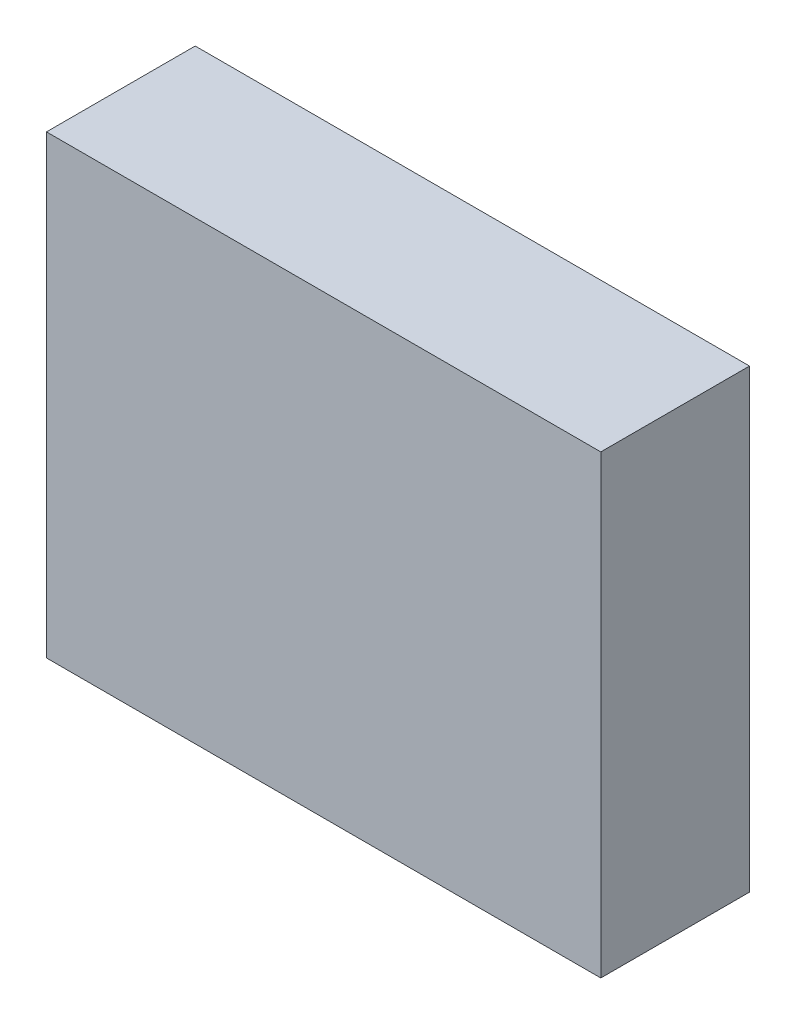
from build123d import *

# Parameters (mm, degrees)
SKETCH1_W               = 3.727
SKETCH1_H               = 3.0635
COMPONENT_OUTLINE_DEPTH = 1


with BuildPart() as part:
    # Sketch1 → Component_Outline (new body)
    with BuildSketch(Plane.XY):
        with Locations((0, 0.03175)):
            Rectangle(SKETCH1_W, SKETCH1_H)
    extrude(amount=COMPONENT_OUTLINE_DEPTH)


solid = part.part
